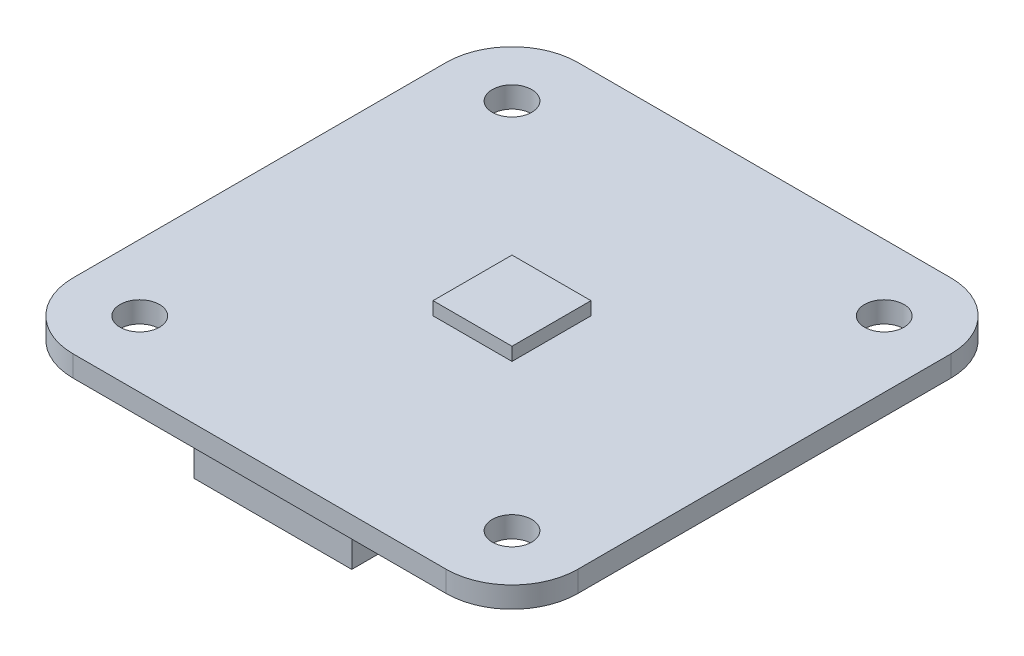
from build123d import *

# Parameters (mm, degrees)
SKETCH1_W           = 38.35
SKETCH1_H           = 38.35
BOSS_EXTRUDE1_DEPTH = 1.6
FILLET1_R           = 5
SKETCH2_R           = 1.5
CUT_EXTRUDE1_DEPTH  = 1.6
SKETCH3_W           = 6
SKETCH3_H           = 6
BOSS_EXTRUDE2_DEPTH = 1
SKETCH4_W           = 12
SKETCH4_H           = 8
BOSS_EXTRUDE3_DEPTH = 3


with BuildPart() as part:
    # Sketch1 → Boss-Extrude1 (new body)
    with BuildSketch(Plane(origin=(0, 0, 0), x_dir=(1, 0, 0), z_dir=(0, 1, 0))):
        Rectangle(SKETCH1_W, SKETCH1_H)
    extrude(amount=BOSS_EXTRUDE1_DEPTH)

    # Fillet1
    fillet1_edges = [part.edges().sort_by_distance(p)[0] for p in [
        (19.175, 0.8, 19.175),
        (-19.175, 0.8, 19.175),
        (-19.175, 0.8, -19.175),
        (19.175, 0.8, -19.175),
    ]]
    fillet(fillet1_edges, radius=FILLET1_R)

    # Sketch2 → Cut-Extrude1 (cut)
    with BuildSketch(Plane(origin=(0, 1.6, 0), x_dir=(1, 0, 0), z_dir=(0, 1, 0))):
        with Locations(Location((-14.142135624, 14.142135624, 0), (0, 0, 270))):
            Circle(SKETCH2_R)
        with Locations(Location((14.142135624, 14.142135624, 0), (0, 0, 270))):
            Circle(SKETCH2_R)
        with Locations(Location((-14.142135624, -14.142135624, 0), (0, 0, 270))):
            Circle(SKETCH2_R)
        with Locations(Location((14.142135624, -14.142135624, 0), (0, 0, 270))):
            Circle(SKETCH2_R)
    extrude(amount=-CUT_EXTRUDE1_DEPTH, mode=Mode.SUBTRACT)

    # Sketch3 → Boss-Extrude2 (add)
    with BuildSketch(Plane(origin=(0, 1.6, 0), x_dir=(1, 0, 0), z_dir=(0, 1, 0))):
        Rectangle(SKETCH3_W, SKETCH3_H)
    extrude(amount=BOSS_EXTRUDE2_DEPTH)

    # Sketch4 → Boss-Extrude3 (add)
    with BuildSketch(Plane.XZ):
        with Locations((0, 14.175)):
            Rectangle(SKETCH4_W, SKETCH4_H)
    extrude(amount=BOSS_EXTRUDE3_DEPTH)


solid = part.part
